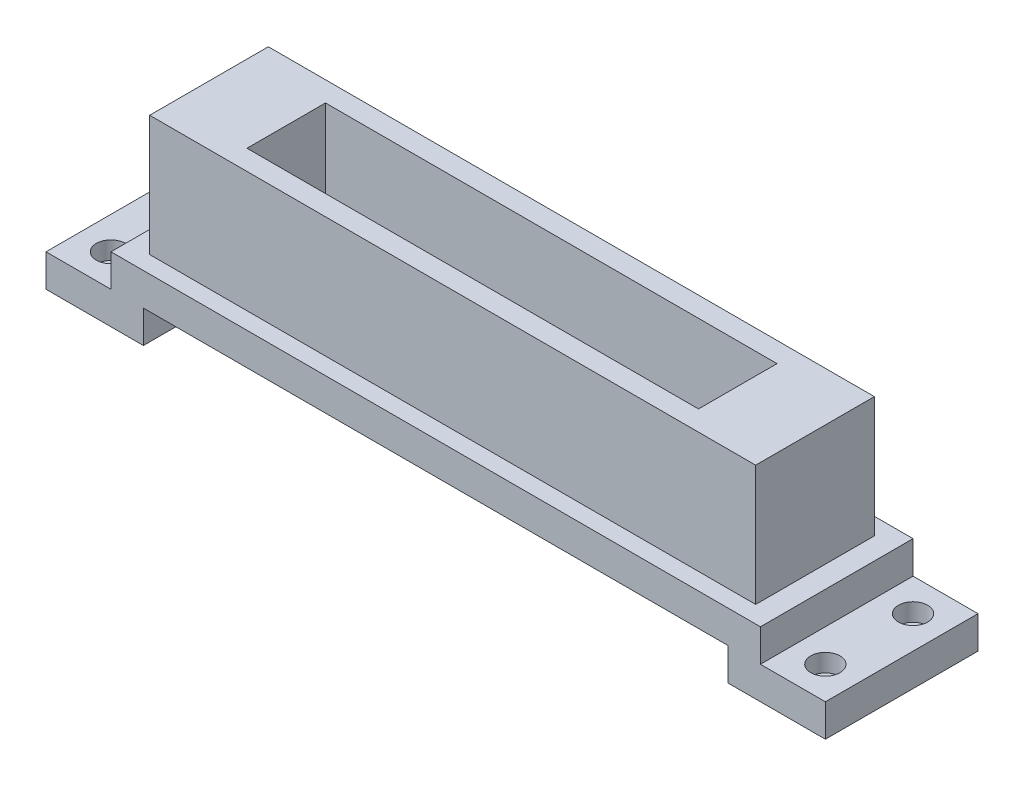
from build123d import *

# Parameters (mm, degrees)
SKETCH_1_W                    = 480
SKETCH_1_H                    = 94
EXTRUDE_1_DEPTH               = 40
SKETCH_2_W                    = 40
SKETCH_2_H                    = 20
CUT_EXTRUDE_1_DEPTH           = 259.526594377
SKETCH_3_W                    = 360
SKETCH_3_H                    = 20
CUT_EXTRUDE_2_DEPTH           = 259.526594377
SKETCH_4_W                    = 40
SKETCH_4_H                    = 20
CUT_EXTRUDE_3_DEPTH           = 259.526594377
HOLE_WIZARD_M10_1_D           = 11
HOLE_WIZARD_M10_1_CBORE_D     = 18
HOLE_WIZARD_M10_1_CBORE_DEPTH = 11
SKETCH_14_W                   = 373.229690018
SKETCH_14_H                   = 73.09887193
EXTRUDE_2_DEPTH               = 74.29
SKETCH_15_W                   = 278.085126552
SKETCH_15_H                   = 48.34581477
CUT_EXTRUDE_4_DEPTH           = 74.29


with BuildPart() as part:
    # 草图1 → 凸台-拉伸1 (new body)
    with BuildSketch(Plane.XZ.offset(20)):
        Rectangle(SKETCH_1_W, SKETCH_1_H)
    extrude(amount=-EXTRUDE_1_DEPTH)

    # 草图2 → 切除-拉伸1 (cut, through all)
    with BuildSketch(Plane(origin=(0, 0, -47), x_dir=(-1, 0, 0), z_dir=(0, 0, -1))):
        with Locations((220, 10)):
            Rectangle(SKETCH_2_W, SKETCH_2_H)
    extrude(amount=-CUT_EXTRUDE_1_DEPTH, mode=Mode.SUBTRACT)

    # 草图3 → 切除-拉伸2 (cut, through all)
    with BuildSketch(Plane(origin=(0, 0, -47), x_dir=(-1, 0, 0), z_dir=(0, 0, -1))):
        with Locations((0, -10)):
            Rectangle(SKETCH_3_W, SKETCH_3_H)
    extrude(amount=-CUT_EXTRUDE_2_DEPTH, mode=Mode.SUBTRACT)

    # 草图4 → 切除-拉伸3 (cut, through all)
    with BuildSketch(Plane(origin=(0, 0, -47), x_dir=(-1, 0, 0), z_dir=(0, 0, -1))):
        with Locations((-220, 10)):
            Rectangle(SKETCH_4_W, SKETCH_4_H)
    extrude(amount=-CUT_EXTRUDE_3_DEPTH, mode=Mode.SUBTRACT)

    # M10 六角头螺栓的柱形沉头孔1 (through all)
    with Locations(Plane(origin=(0, 0, 0), x_dir=(1, 0, 0), z_dir=(0, 1, 0))):
        with Locations((220, -27), (220, 27), (-220, -27), (-220, 27)):
            CounterBoreHole(HOLE_WIZARD_M10_1_D / 2, HOLE_WIZARD_M10_1_CBORE_D / 2, HOLE_WIZARD_M10_1_CBORE_DEPTH)

    # 草图14 → 凸台-拉伸2 (add)
    with BuildSketch(Plane(origin=(0, 20, 0), x_dir=(1, 0, 0), z_dir=(0, 1, 0))):
        Rectangle(SKETCH_14_W, SKETCH_14_H)
    extrude(amount=EXTRUDE_2_DEPTH)

    # 草图15 → 切除-拉伸4 (cut)
    with BuildSketch(Plane(origin=(0, 94.29, 0), x_dir=(1, 0, 0), z_dir=(0, 1, 0))):
        Rectangle(SKETCH_15_W, SKETCH_15_H)
    extrude(amount=-CUT_EXTRUDE_4_DEPTH, mode=Mode.SUBTRACT)


solid = part.part
